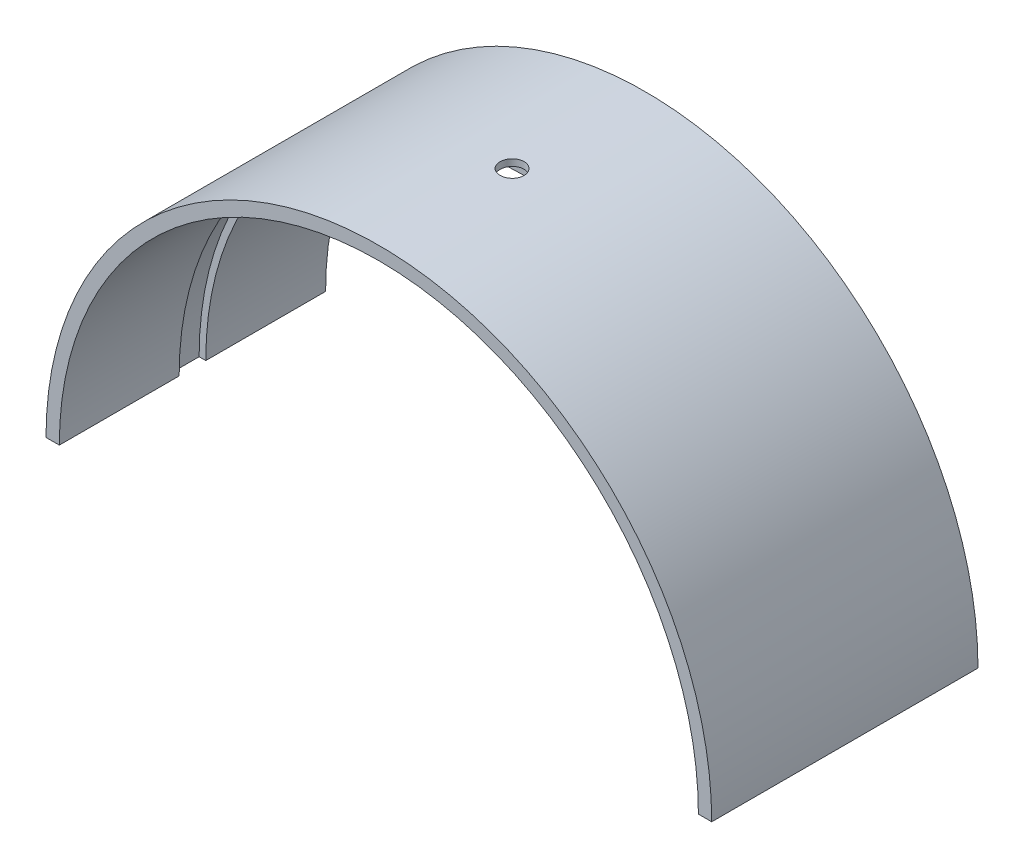
from build123d import *

# Parameters (mm, degrees)
BOSS_EXTRUDE1_DEPTH = 20
SKETCH2_W           = 0.5
SKETCH2_H           = 2
SKETCH3_R           = 0.9
CUT_EXTRUDE1_DEPTH  = 41.620192023


with BuildPart() as part:
    # Sketch1 → Boss-Extrude1 (new body)
    with BuildSketch(Plane.XY):
        with BuildLine():
            Line((25, 0), (24, 0))
            ThreePointArc((24, 0), (0, 24), (-24, 0))
            Line((-24, 0), (-25, 0))
            ThreePointArc((-25, 0), (0, 25), (25, 0))
        make_face()
    extrude(amount=BOSS_EXTRUDE1_DEPTH)

    # Sketch2 → Cut-Revolve1 (revolve, cut)
    with BuildSketch(Plane.XZ):
        with Locations((-24.25, 10)):
            Rectangle(SKETCH2_W, SKETCH2_H)
    revolve(axis=Axis((0, 0, 0), (0, 0, 1)), mode=Mode.SUBTRACT)

    # Sketch3 → Cut-Extrude1 (cut, through all)
    with BuildSketch(Plane.XZ):
        with Locations(Location((0, 10, 0), (0, 0, 270))):
            Circle(SKETCH3_R)
    extrude(amount=-CUT_EXTRUDE1_DEPTH, mode=Mode.SUBTRACT)


solid = part.part
